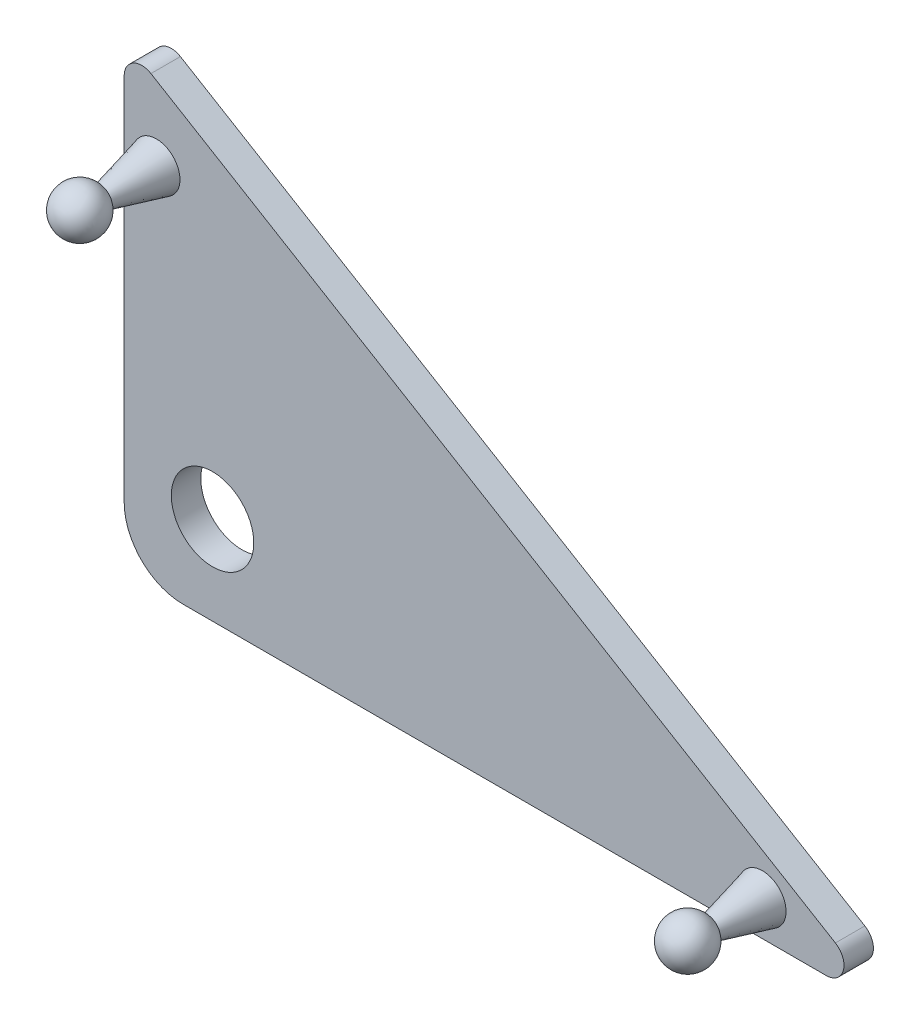
from build123d import *

# Parameters (mm, degrees)
ESTRUSIONE_ESTRUSIONE1_DEPTH = 5
SCHIZZO2_R                   = 7
TAGLIO_ESTRUSIONE1_DEPTH     = 152.6871781
RACCORDO1_R                  = 10
SCHIZZO3_R                   = 4
ESTRUSIONE_ESTRUSIONE2_DEPTH = 10
ESTRUSIONE_ESTRUSIONE2_TAPER = 14
RACCORDO2_R                  = 3
SCHIZZO6_R                   = 4
ESTRUSIONE_ESTRUSIONE3_DEPTH = 10
ESTRUSIONE_ESTRUSIONE3_TAPER = 14


with BuildPart() as part:
    # Schizzo1 → Estrusione-Estrusione1 (new body)
    with BuildSketch(Plane.XY):
        Polygon((0, 0), (0, 78), (130, 0), align=None)
    extrude(amount=ESTRUSIONE_ESTRUSIONE1_DEPTH)

    # Schizzo2 → Taglio-Estrusione1 (cut, through all)
    with BuildSketch(Plane(origin=(0, 0, 0), x_dir=(-1, 0, 0), z_dir=(0, 0, -1))):
        with Locations((-15, 15)):
            Circle(SCHIZZO2_R)
    extrude(amount=-TAGLIO_ESTRUSIONE1_DEPTH, mode=Mode.SUBTRACT)

    # Raccordo1
    raccordo1_edges = [part.edges().sort_by_distance(p)[0] for p in [
        (0, 0, 2.5),
    ]]
    fillet(raccordo1_edges, radius=RACCORDO1_R)

    # Schizzo3 → Estrusione-Estrusione2 (add)
    with BuildSketch(Plane.XY.offset(5)):
        with Locations((5.463985213, 62.137606809)):
            Circle(SCHIZZO3_R)
    extrude(amount=ESTRUSIONE_ESTRUSIONE2_DEPTH, taper=ESTRUSIONE_ESTRUSIONE2_TAPER)

    # Schizzo5 → Rivoluzione1 (revolve)
    with BuildSketch(Plane(origin=(0, 62.137606809, 0), x_dir=(1, 0, 0), z_dir=(0, 1, 0))):
        with BuildLine():
            Line((9.463985213, -18), (1.463985213, -18))
            ThreePointArc((1.463985213, -18), (5.463985213, -22), (9.463985213, -18))
        make_face()
    revolve(axis=Axis((9.463985213, 62.137606809, 18), (-1, 0, 0)))

    # Raccordo2
    raccordo2_edges = [part.edges().sort_by_distance(p)[0] for p in [
        (0, 78, 2.5),
        (130, 0, 2.5),
    ]]
    fillet(raccordo2_edges, radius=RACCORDO2_R)

    # Schizzo6 → Estrusione-Estrusione3 (add)
    with BuildSketch(Plane.XY.offset(5)):
        with Locations((108.33809621, 6)):
            Circle(SCHIZZO6_R)
    extrude(amount=ESTRUSIONE_ESTRUSIONE3_DEPTH, taper=ESTRUSIONE_ESTRUSIONE3_TAPER)

    # Schizzo9 → Rivoluzione3 (revolve)
    with BuildSketch(Plane(origin=(0, 6, 0), x_dir=(1, 0, 0), z_dir=(0, 1, 0))):
        with BuildLine():
            Line((112.33809621, -17.694136404), (104.33809621, -17.694136404))
            ThreePointArc((104.33809621, -17.694136404), (108.33809621, -21.694136404), (112.33809621, -17.694136404))
        make_face()
    revolve(axis=Axis((112.33809621, 6, 17.694136404), (-1, 0, 0)))


solid = part.part
